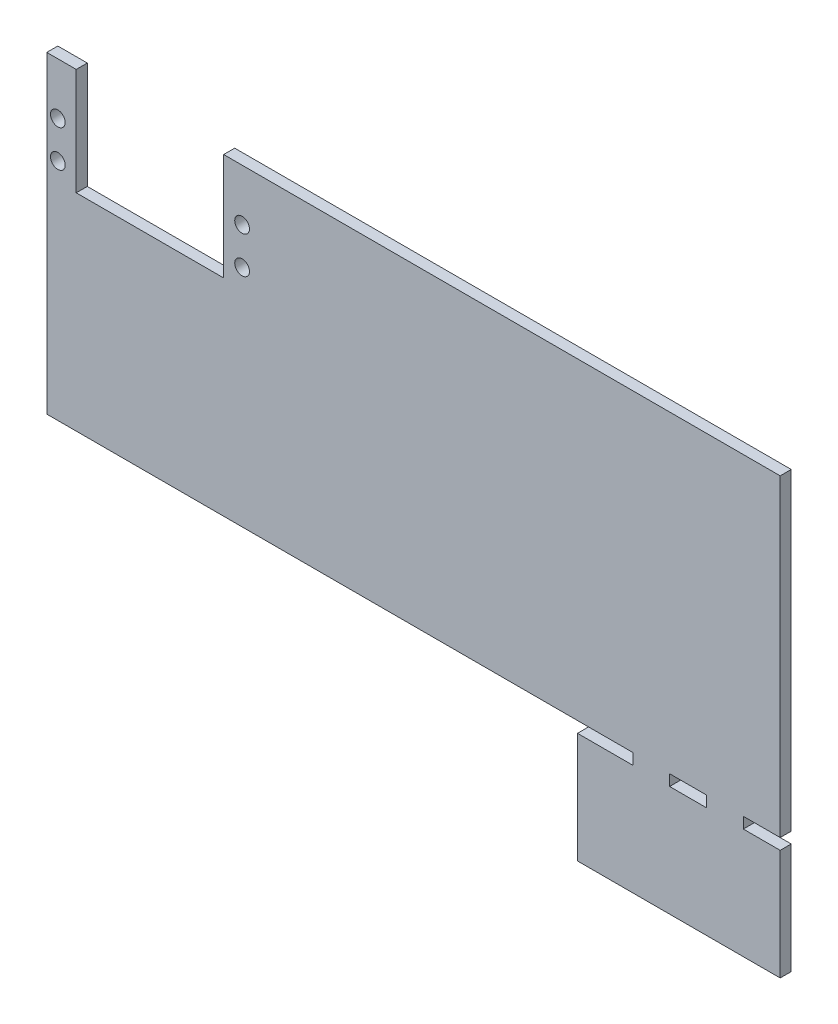
from build123d import *

# Parameters (mm, degrees)
SKETCH1_W           = 55
SKETCH1_H           = 55
BOSS_EXTRUDE1_DEPTH = 3
SKETCH2_W           = 10
SKETCH2_H           = 3
SKETCH2_W_2         = 15
CUT_EXTRUDE1_DEPTH  = 3
SKETCH3_W           = 55
SKETCH3_H           = 30
BOSS_EXTRUDE2_DEPTH = 3
SKETCH4_W           = 144
SKETCH4_H           = 52
BOSS_EXTRUDE3_DEPTH = 3
SKETCH5_W           = 199
SKETCH5_H           = 13
BOSS_EXTRUDE4_DEPTH = 3
SKETCH6_W           = 199
SKETCH6_H           = 20
BOSS_EXTRUDE5_DEPTH = 3
SKETCH7_R           = 2
SKETCH7_W           = 40
SKETCH7_H           = 20
CUT_EXTRUDE22_DEPTH = 33
SKETCH8_W           = 40
SKETCH8_H           = 9
CUT_EXTRUDE23_DEPTH = 33


with BuildPart() as part:
    # Sketch1 → Boss-Extrude1 (new body)
    with BuildSketch(Plane.XY):
        Rectangle(SKETCH1_W, SKETCH1_H)
    extrude(amount=BOSS_EXTRUDE1_DEPTH)

    # Sketch2 → Cut-Extrude1 (cut)
    with BuildSketch(Plane.XY.offset(3)):
        with Locations((22.5, -26)):
            Rectangle(SKETCH2_W, SKETCH2_H)
        with Locations((2.5, -26)):
            Rectangle(SKETCH2_W, SKETCH2_H)
        with Locations((-20, -26)):
            Rectangle(SKETCH2_W_2, SKETCH2_H)
    extrude(amount=-CUT_EXTRUDE1_DEPTH, mode=Mode.SUBTRACT)

    # Sketch3 → Boss-Extrude2 (add)
    with BuildSketch(Plane(origin=(0, 0, 0), x_dir=(-1, 0, 0), z_dir=(0, 0, -1))):
        with Locations((0, -42.5)):
            Rectangle(SKETCH3_W, SKETCH3_H)
    extrude(amount=-BOSS_EXTRUDE2_DEPTH)

    # Sketch4 → Boss-Extrude3 (add)
    with BuildSketch(Plane(origin=(0, 0, 0), x_dir=(-1, 0, 0), z_dir=(0, 0, -1))):
        with Locations((99.5, 1.5)):
            Rectangle(SKETCH4_W, SKETCH4_H)
    extrude(amount=-BOSS_EXTRUDE3_DEPTH)

    # Sketch5 → Boss-Extrude4 (add)
    with BuildSketch(Plane(origin=(0, 0, 0), x_dir=(-1, 0, 0), z_dir=(0, 0, -1))):
        with Locations((72, 34)):
            Rectangle(SKETCH5_W, SKETCH5_H)
    extrude(amount=-BOSS_EXTRUDE4_DEPTH)

    # Sketch6 → Boss-Extrude5 (add)
    with BuildSketch(Plane(origin=(0, 0, 0), x_dir=(-1, 0, 0), z_dir=(0, 0, -1))):
        with Locations((72, 50.5)):
            Rectangle(SKETCH6_W, SKETCH6_H)
    extrude(amount=-BOSS_EXTRUDE5_DEPTH)

    # Sketch7 → Cut-Extrude22 (cut)
    with BuildSketch(Plane(origin=(0, 0, 0), x_dir=(-1, 0, 0), z_dir=(0, 0, -1))):
        with Locations((168.5, 46.5)):
            Circle(SKETCH7_R)
        with Locations((168.5, 36.5)):
            Circle(SKETCH7_R)
        with Locations((118.5, 36.5)):
            Circle(SKETCH7_R)
        with Locations((118.5, 46.5)):
            Circle(SKETCH7_R)
        with Locations((143.5, 41.5)):
            Rectangle(SKETCH7_W, SKETCH7_H)
    extrude(amount=-CUT_EXTRUDE22_DEPTH, mode=Mode.SUBTRACT)

    # Sketch8 → Cut-Extrude23 (cut)
    with BuildSketch(Plane(origin=(0, 0, 0), x_dir=(-1, 0, 0), z_dir=(0, 0, -1))):
        with Locations((143.5, 56)):
            Rectangle(SKETCH8_W, SKETCH8_H)
    extrude(amount=-CUT_EXTRUDE23_DEPTH, mode=Mode.SUBTRACT)


solid = part.part
